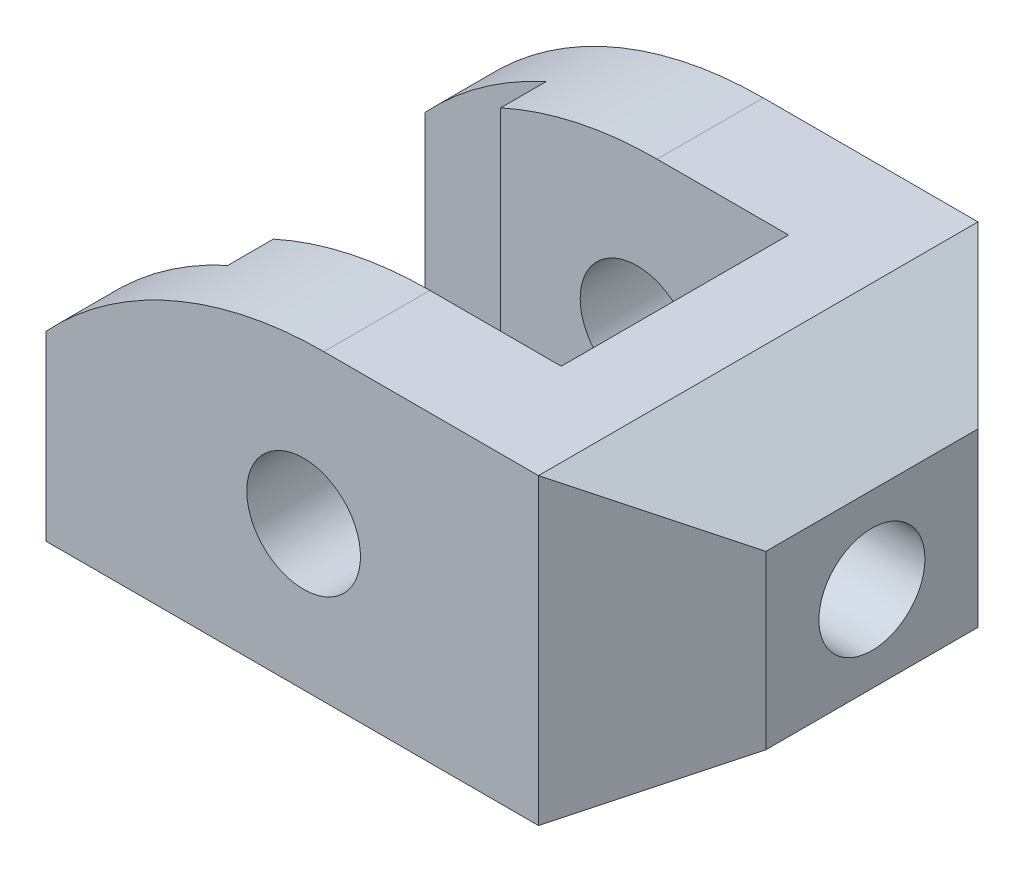
from build123d import *

# Parameters (mm, degrees)
SKETCH2_R           = 7.5
BOSS_EXTRUDE1_DEPTH = 29
CUT_EXTRUDE1_DEPTH  = 95.026591983
SKETCH4_R           = 7
CUT_EXTRUDE2_DEPTH  = 95.026591983


with BuildPart() as part:
    # Sketch2 → Boss-Extrude1 (new, symmetric)
    with BuildSketch(Plane.XY):
        with BuildLine():
            Line((0, 0), (0, 24))
            ThreePointArc((0, 24), (16.66060556, 35.82575695), (36.66060556, 40))
            Line((36.66060556, 40), (65, 40))
            Line((65, 40), (80, 31.339745962))
            Line((80, 31.339745962), (80, 8.660254038))
            Line((80, 8.660254038), (65, 0))
            Line((65, 0), (0, 0))
        make_face()
        with Locations(Location((34, 19, 0), (0, 0, 180))):
            Circle(SKETCH2_R, mode=Mode.SUBTRACT)
    extrude(amount=BOSS_EXTRUDE1_DEPTH, both=True)

    # Sketch3 → Cut-Extrude1 (cut, through all)
    with BuildSketch(Plane(origin=(0, 40, 0), x_dir=(1, 0, 0), z_dir=(0, 1, 0))):
        Polygon((65, 29), (80, 29), (80, 14), align=None)
        Polygon((0, 21), (16, 21), (16, 15), (54, 15), (54, -15), (16, -15), (16, -21), (0, -21), align=None)
        Polygon((80, -29), (80, -14), (65, -29), align=None)
    extrude(amount=-CUT_EXTRUDE1_DEPTH, mode=Mode.SUBTRACT)

    # Sketch4 → Cut-Extrude2 (cut, through all)
    with BuildSketch(Plane(origin=(80, 0, 0), x_dir=(0, 0, -1), z_dir=(1, 0, 0))):
        with Locations((0, 20)):
            Circle(SKETCH4_R)
    extrude(amount=-CUT_EXTRUDE2_DEPTH, mode=Mode.SUBTRACT)


solid = part.part
